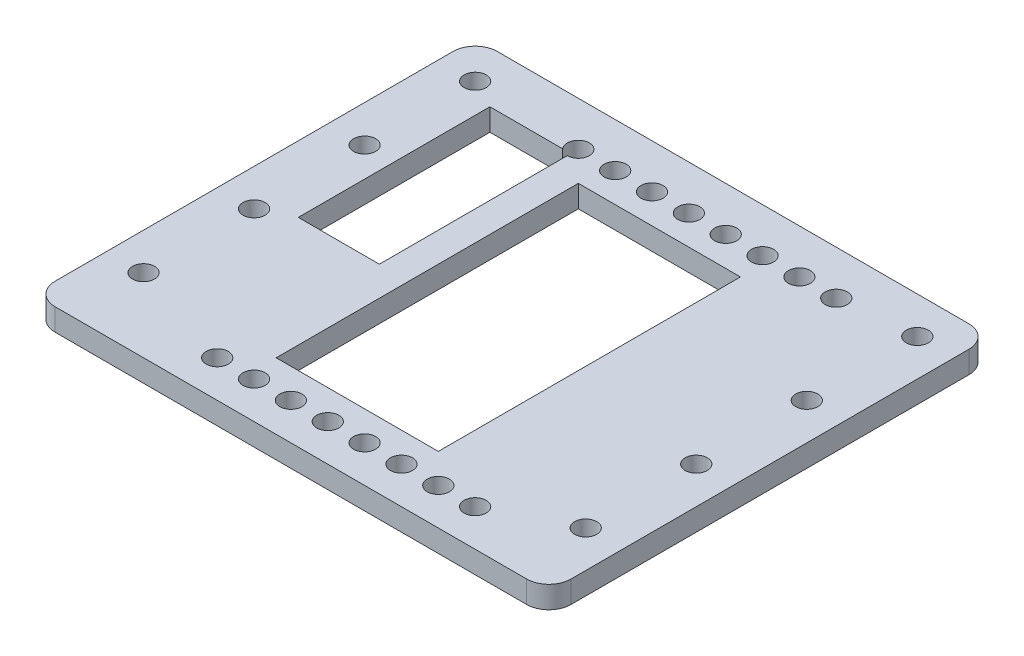
from build123d import *

# Parameters (mm, degrees)
SKETCH1_W           = 70
SKETCH1_H           = 60
ACRYLIC_BOARD_DEPTH = 3
SKETCH2_R           = 1.5
TO_CHASSIS_DEPTH    = 3
SKETCH3_R           = 1.5
SERVO_SCREW_DEPTH   = 3
SKETCH4_W           = 22
SKETCH4_H           = 41
SKETCH4_W_2         = 11
SKETCH4_H_2         = 26
SERVO_DEPTH         = 3
FILLET1_R           = 3


with BuildPart() as part:
    # Sketch1 → Acrylic Board (new body)
    with BuildSketch(Plane(origin=(0, 0, 0), x_dir=(1, 0, 0), z_dir=(0, 1, 0))):
        Rectangle(SKETCH1_W, SKETCH1_H)
    extrude(amount=ACRYLIC_BOARD_DEPTH)

    # Sketch2 → To Chassis (cut)
    with BuildSketch(Plane(origin=(0, 3, 0), x_dir=(1, 0, 0), z_dir=(0, 1, 0))):
        with Locations(Location((-30, 25, 0), (0, 0, 270))):
            Circle(SKETCH2_R)
        with Locations(Location((30, 25, 0), (0, 0, 270))):
            Circle(SKETCH2_R)
        with Locations(Location((30, 10, 0), (0, 0, 270))):
            Circle(SKETCH2_R)
        with Locations(Location((30, -5, 0), (0, 0, 270))):
            Circle(SKETCH2_R)
        with Locations(Location((30, -20, 0), (0, 0, 270))):
            Circle(SKETCH2_R)
        with Locations(Location((-30, 10, 0), (0, 0, 270))):
            Circle(SKETCH2_R)
        with Locations(Location((-30, -5, 0), (0, 0, 270))):
            Circle(SKETCH2_R)
        with Locations(Location((-30, -20, 0), (0, 0, 270))):
            Circle(SKETCH2_R)
    extrude(amount=-TO_CHASSIS_DEPTH, mode=Mode.SUBTRACT)

    # Sketch3 → Servo Screw (cut)
    with BuildSketch(Plane(origin=(0, 3, 0), x_dir=(1, 0, 0), z_dir=(0, 1, 0))):
        with Locations(Location((20, -25, 0), (0, 0, 270))):
            Circle(SKETCH3_R)
        with Locations(Location((15, -25, 0), (0, 0, 270))):
            Circle(SKETCH3_R)
        with Locations(Location((5, -25, 0), (0, 0, 270))):
            Circle(SKETCH3_R)
        with Locations(Location((10, -25, 0), (0, 0, 270))):
            Circle(SKETCH3_R)
        with Locations(Location((-5, -25, 0), (0, 0, 270))):
            Circle(SKETCH3_R)
        with Locations(Location((-10, -25, 0), (0, 0, 270))):
            Circle(SKETCH3_R)
        with Locations(Location((-15, -25, 0), (0, 0, 270))):
            Circle(SKETCH3_R)
        with Locations(Location((-15, 24, 0), (0, 0, 270))):
            Circle(SKETCH3_R)
        with Locations(Location((-10, 24, 0), (0, 0, 270))):
            Circle(SKETCH3_R)
        with Locations(Location((0, 24, 0), (0, 0, 270))):
            Circle(SKETCH3_R)
        with Locations(Location((5, 24, 0), (0, 0, 270))):
            Circle(SKETCH3_R)
        with Locations(Location((10, 24, 0), (0, 0, 270))):
            Circle(SKETCH3_R)
        with Locations(Location((15, 24, 0), (0, 0, 270))):
            Circle(SKETCH3_R)
        with Locations(Location((20, 24, 0), (0, 0, 270))):
            Circle(SKETCH3_R)
        with Locations(Location((0, -25, 0), (0, 0, 270))):
            Circle(SKETCH3_R)
        with Locations(Location((-5, 24, 0), (0, 0, 270))):
            Circle(SKETCH3_R)
    extrude(amount=-SERVO_SCREW_DEPTH, mode=Mode.SUBTRACT)

    # Sketch4 → Servo (cut)
    with BuildSketch(Plane(origin=(0, 3, 0), x_dir=(1, 0, 0), z_dir=(0, 1, 0))):
        with Locations((0, -0.5)):
            Rectangle(SKETCH4_W, SKETCH4_H)
        with Locations((-20.5, 10)):
            Rectangle(SKETCH4_W_2, SKETCH4_H_2)
    extrude(amount=-SERVO_DEPTH, mode=Mode.SUBTRACT)

    # Fillet1
    fillet1_edges = [part.edges().sort_by_distance(p)[0] for p in [
        (-35, 1.5, -30),
        (35, 1.5, -30),
        (35, 1.5, 30),
        (-35, 1.5, 30),
    ]]
    fillet(fillet1_edges, radius=FILLET1_R)


solid = part.part
